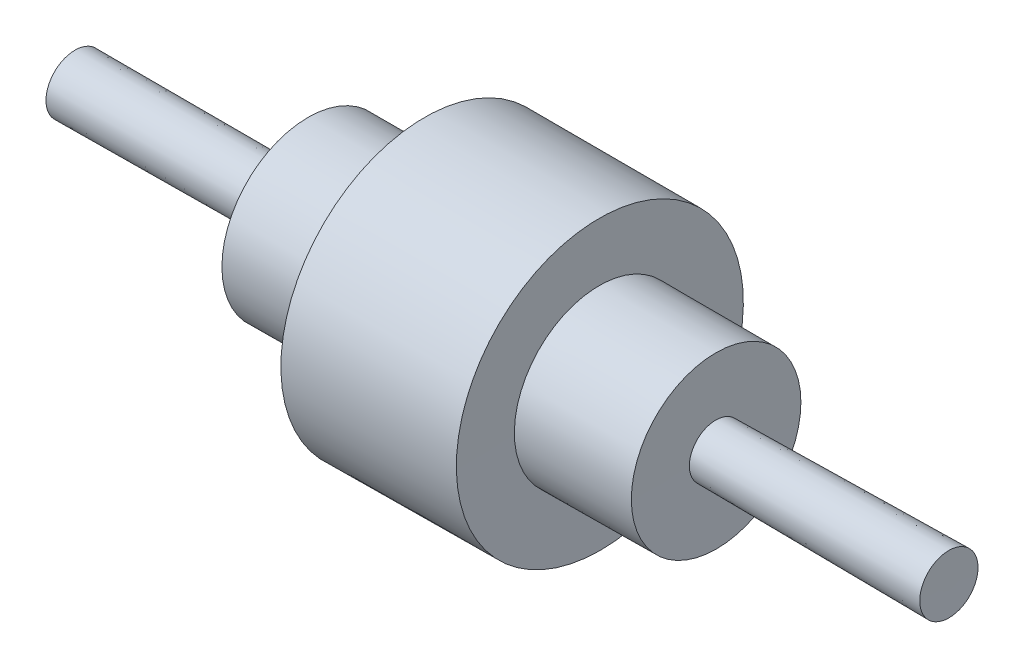
from build123d import *


with BuildPart() as part:
    # Sketch1 → Revolve1 (revolve)
    with BuildSketch(Plane.XY):
        Polygon((0, 0), (0, 10000), (80000, 10000), (80000, 30000), (120000, 30000), (120000, 50000), (180000, 50000), (180000, 30000), (220000, 30000), (220000, 10000), (299990.793695057, 11213.640817894), (299990.793695057, 1213.640817894), align=None)
    revolve(axis=Axis((0, 0, 0), (0.999991816686894, 0.0040455604365155435, 0)))


solid = part.part
